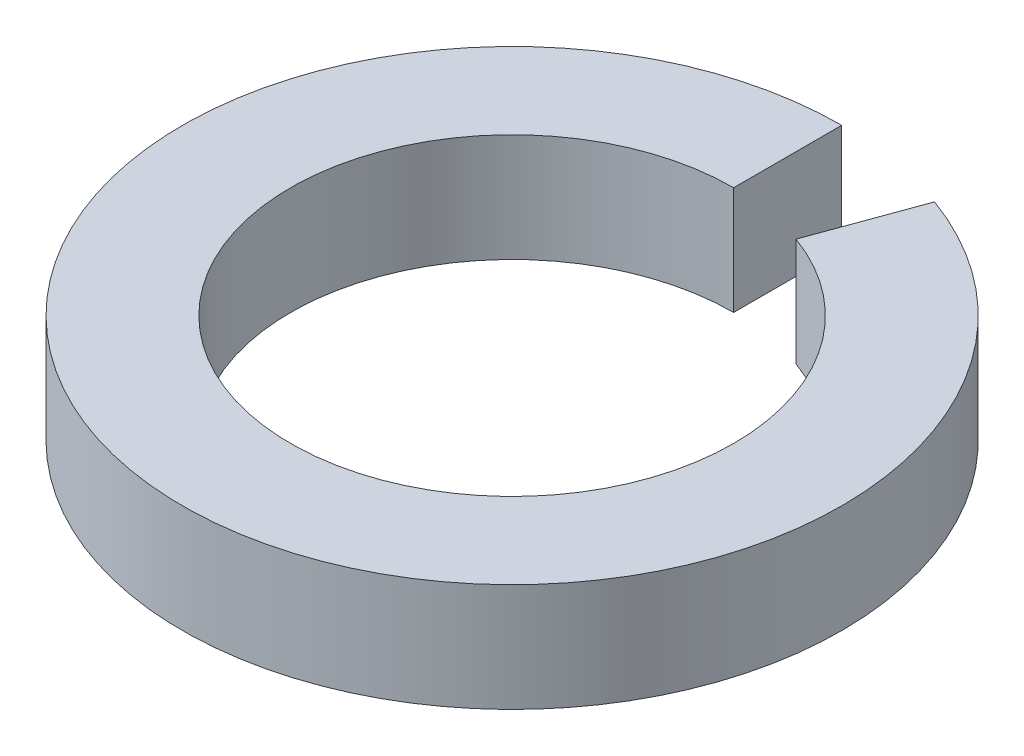
from build123d import *

# Parameters (mm, degrees)
BOSS_EXTRUDE1_DEPTH = 2


with BuildPart() as part:
    # Sketch1 → Boss-Extrude1 (new body)
    with BuildSketch(Plane(origin=(0, 0, 0), x_dir=(1, 0, 0), z_dir=(0, 1, 0))):
        with BuildLine():
            Line((0, 4.1), (0, 6.1))
            ThreePointArc((0, 6.1), (-1.059253884, -6.007327293), (2.086322874, 5.732124987))
            Line((2.086322874, 5.732124987), (1.402282588, 3.852739745))
            ThreePointArc((1.402282588, 3.852739745), (-0.711957528, -4.037711787), (0, 4.1))
        make_face()
    extrude(amount=BOSS_EXTRUDE1_DEPTH)


solid = part.part
